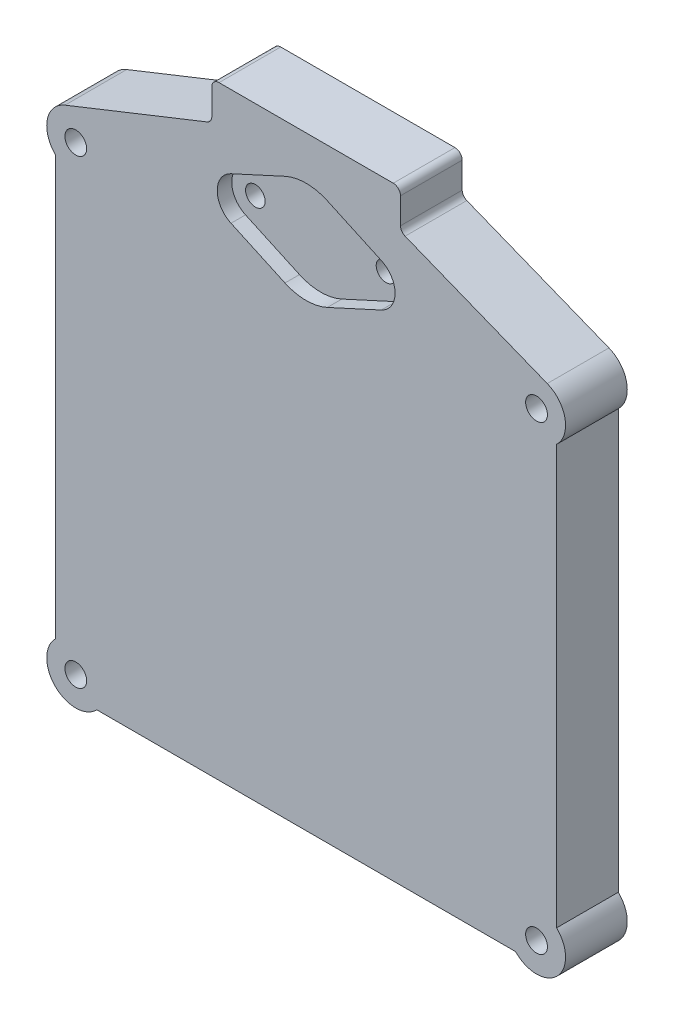
from build123d import *

# Parameters (mm, degrees)
EXTRUDE_1_DEPTH     = 17
SKETCH_2_R          = 3
CUT_EXTRUDE_1_DEPTH = 10
CUT_EXTRUDE_2_DEPTH = 4
SKETCH_5_R          = 2.7
CUT_EXTRUDE_3_DEPTH = 20


with BuildPart() as part:
    # 草图1 → 凸台-拉伸1 (new body)
    with BuildSketch(Plane.XY):
        with BuildLine():
            Line((-57.689289948, -69), (57.689289948, -69))
            ThreePointArc((57.689289948, -69), (69.131727984, -69.131727984), (69, -57.689289948))
            Line((69, -57.689289948), (69, 57.689289948))
            ThreePointArc((69, 57.689289948), (71.327983317, 65.000871727), (66.431261108, 70.908565529))
            Line((66.431261108, 70.908565529), (27.260903157, 86.486659817))
            ThreePointArc((27.260903157, 86.486659817), (26.344978295, 87.222183323), (26, 88.345082765))
            Line((26, 88.345082765), (26, 95.5))
            ThreePointArc((26, 95.5), (25.414213562, 96.914213562), (24, 97.5))
            Line((24, 97.5), (-24, 97.5))
            ThreePointArc((-24, 97.5), (-25.414213562, 96.914213562), (-26, 95.5))
            Line((-26, 95.5), (-26, 88.345082765))
            ThreePointArc((-26, 88.345082765), (-26.344978295, 87.222183323), (-27.260903157, 86.486659817))
            Line((-27.260903157, 86.486659817), (-66.431261108, 70.908565529))
            ThreePointArc((-66.431261108, 70.908565529), (-71.327983317, 65.000871727), (-69, 57.689289948))
            Line((-69, 57.689289948), (-69, -57.689289948))
            ThreePointArc((-69, -57.689289948), (-69.131727984, -69.131727984), (-57.689289948, -69))
        make_face()
    extrude(amount=EXTRUDE_1_DEPTH)

    # 草图2 → 切除-拉伸1 (cut)
    with BuildSketch(Plane.XY.offset(17)):
        with Locations((-63.474873734, 63.474873734)):
            Circle(SKETCH_2_R)
        with Locations((63.474873734, 63.474873734)):
            Circle(SKETCH_2_R)
        with Locations((-63.474873734, -63.474873734)):
            Circle(SKETCH_2_R)
        with Locations((63.474873734, -63.474873734)):
            Circle(SKETCH_2_R)
    extrude(amount=-CUT_EXTRUDE_1_DEPTH, mode=Mode.SUBTRACT)

    # 草图3 → 切除-拉伸2 (cut)
    with BuildSketch(Plane.XY.offset(17)):
        with BuildLine():
            Line((-20.708333333, 77.408885729), (-5.833333333, 84.2268308))
            ThreePointArc((-5.833333333, 84.2268308), (-2.985328189, 85.178004811), (0, 85.5))
            ThreePointArc((0, 85.5), (2.985328189, 85.178004811), (5.833333333, 84.2268308))
            Line((5.833333333, 84.2268308), (20.708333333, 77.408885729))
            ThreePointArc((20.708333333, 77.408885729), (24.5, 71.5), (20.708333333, 65.591114271))
            Line((20.708333333, 65.591114271), (5.833333333, 58.7731692))
            ThreePointArc((5.833333333, 58.7731692), (2.985328189, 57.821995189), (0, 57.5))
            ThreePointArc((0, 57.5), (-2.985328189, 57.821995189), (-5.833333333, 58.7731692))
            Line((-5.833333333, 58.7731692), (-20.708333333, 65.591114271))
            ThreePointArc((-20.708333333, 65.591114271), (-24.5, 71.5), (-20.708333333, 77.408885729))
        make_face()
    extrude(amount=-CUT_EXTRUDE_2_DEPTH, mode=Mode.SUBTRACT)

    # 草图5 → 切除-拉伸3 (cut)
    with BuildSketch(Plane.XY.offset(13)):
        with Locations((-18, 71.5)):
            Circle(SKETCH_5_R)
        with Locations((18, 71.5)):
            Circle(SKETCH_5_R)
    extrude(amount=-CUT_EXTRUDE_3_DEPTH, mode=Mode.SUBTRACT)


solid = part.part
